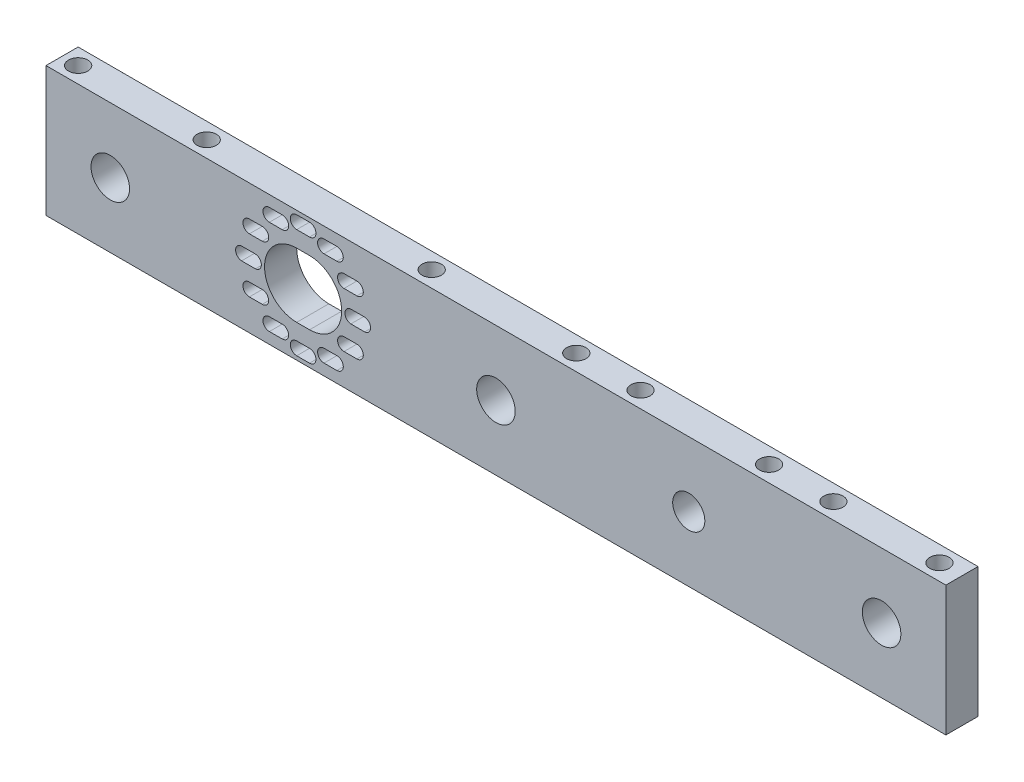
from build123d import *

# Parameters (mm, degrees)
SKETCH_1_W          = 140
SKETCH_1_H          = 20.2
SKETCH_1_R          = 3
SKETCH_1_R_2        = 2.5
EXTRUDE_1_DEPTH     = 5
CUT_EXTRUDE_1_DEPTH = 41


with BuildPart() as part:
    # 스케치1 → 돌출1 (new body)
    with BuildSketch(Plane.XY):
        with Locations((12.953994506, 0)):
            Rectangle(SKETCH_1_W, SKETCH_1_H)
        with Locations((-47.044353904, 0)):
            Circle(SKETCH_1_R, mode=Mode.SUBTRACT)
        with Locations((12.955646096, 0)):
            Circle(SKETCH_1_R, mode=Mode.SUBTRACT)
        with Locations((42.953994506, 0)):
            Circle(SKETCH_1_R_2, mode=Mode.SUBTRACT)
        with Locations((72.953994506, 0)):
            Circle(SKETCH_1_R, mode=Mode.SUBTRACT)
        with BuildLine():
            Line((-16.044353904, 5), (-18.044353904, 5))
            ThreePointArc((-18.044353904, 5), (-23.044353904, 0), (-18.044353904, -5))
            Line((-18.044353904, -5), (-16.044353904, -5))
            ThreePointArc((-16.044353904, -5), (-11.044353904, 0), (-16.044353904, 5))
        make_face(mode=Mode.SUBTRACT)
        with BuildLine():
            Line((-16.044353904, 7.5), (-18.044353904, 7.5))
            ThreePointArc((-18.044353904, 7.5), (-19.044353904, 8.5), (-18.044353904, 9.5))
            Line((-18.044353904, 9.5), (-16.044353904, 9.5))
            ThreePointArc((-16.044353904, 9.5), (-15.044353904, 8.5), (-16.044353904, 7.5))
        make_face(mode=Mode.SUBTRACT)
        with BuildLine():
            Line((-10.683137972, -5.25), (-8.683137972, -5.25))
            ThreePointArc((-8.683137972, -5.25), (-7.683137972, -4.25), (-8.683137972, -3.25))
            Line((-8.683137972, -3.25), (-10.683137972, -3.25))
            ThreePointArc((-10.683137972, -3.25), (-11.683137972, -4.25), (-10.683137972, -5.25))
        make_face(mode=Mode.SUBTRACT)
        with BuildLine():
            Line((-9.620718033, -1), (-7.467989775, -1))
            ThreePointArc((-7.467989775, -1), (-6.543625234, 0.036752017), (-7.544353904, 1))
            Line((-7.544353904, 1), (-9.544353904, 1))
            ThreePointArc((-9.544353904, 1), (-10.545082573, 0.036752017), (-9.620718033, -1))
        make_face(mode=Mode.SUBTRACT)
        with BuildLine():
            Line((-20.294353904, 8.361215932), (-22.294353904, 8.361215932))
            ThreePointArc((-22.294353904, 8.361215932), (-23.294353904, 7.361215932), (-22.294353904, 6.361215932))
            Line((-22.294353904, 6.361215932), (-20.294353904, 6.361215932))
            ThreePointArc((-20.294353904, 6.361215932), (-19.294353904, 7.361215932), (-20.294353904, 8.361215932))
        make_face(mode=Mode.SUBTRACT)
        with BuildLine():
            Line((-23.405569836, 5.25), (-25.405569836, 5.25))
            ThreePointArc((-25.405569836, 5.25), (-26.405569836, 4.25), (-25.405569836, 3.25))
            Line((-25.405569836, 3.25), (-23.405569836, 3.25))
            ThreePointArc((-23.405569836, 3.25), (-22.405569836, 4.25), (-23.405569836, 5.25))
        make_face(mode=Mode.SUBTRACT)
        with BuildLine():
            Line((-24.544353904, 1), (-26.544353904, 1))
            ThreePointArc((-26.544353904, 1), (-27.545082573, 0.036752017), (-26.620718033, -1))
            Line((-26.620718033, -1), (-24.467989775, -1))
            ThreePointArc((-24.467989775, -1), (-23.543625234, 0.036752017), (-24.544353904, 1))
        make_face(mode=Mode.SUBTRACT)
        with BuildLine():
            Line((-10.683137972, 3.25), (-8.683137972, 3.25))
            ThreePointArc((-8.683137972, 3.25), (-7.683137972, 4.25), (-8.683137972, 5.25))
            Line((-8.683137972, 5.25), (-10.683137972, 5.25))
            ThreePointArc((-10.683137972, 5.25), (-11.683137972, 4.25), (-10.683137972, 3.25))
        make_face(mode=Mode.SUBTRACT)
        with BuildLine():
            Line((-13.794353904, 6.361215932), (-11.794353904, 6.361215932))
            ThreePointArc((-11.794353904, 6.361215932), (-10.794353904, 7.361215932), (-11.794353904, 8.361215932))
            Line((-11.794353904, 8.361215932), (-13.794353904, 8.361215932))
            ThreePointArc((-13.794353904, 8.361215932), (-14.794353904, 7.361215932), (-13.794353904, 6.361215932))
        make_face(mode=Mode.SUBTRACT)
        with BuildLine():
            Line((-23.405569836, -3.25), (-25.405569836, -3.25))
            ThreePointArc((-25.405569836, -3.25), (-26.405569836, -4.25), (-25.405569836, -5.25))
            Line((-25.405569836, -5.25), (-23.405569836, -5.25))
            ThreePointArc((-23.405569836, -5.25), (-22.405569836, -4.25), (-23.405569836, -3.25))
        make_face(mode=Mode.SUBTRACT)
        with BuildLine():
            Line((-13.794353904, -8.361215932), (-11.794353904, -8.361215932))
            ThreePointArc((-11.794353904, -8.361215932), (-10.794353904, -7.361215932), (-11.794353904, -6.361215932))
            Line((-11.794353904, -6.361215932), (-13.794353904, -6.361215932))
            ThreePointArc((-13.794353904, -6.361215932), (-14.794353904, -7.361215932), (-13.794353904, -8.361215932))
        make_face(mode=Mode.SUBTRACT)
        with BuildLine():
            Line((-20.294353904, -6.361215932), (-22.294353904, -6.361215932))
            ThreePointArc((-22.294353904, -6.361215932), (-23.294353904, -7.361215932), (-22.294353904, -8.361215932))
            Line((-22.294353904, -8.361215932), (-20.294353904, -8.361215932))
            ThreePointArc((-20.294353904, -8.361215932), (-19.294353904, -7.361215932), (-20.294353904, -6.361215932))
        make_face(mode=Mode.SUBTRACT)
        with BuildLine():
            Line((-16.044353904, -9.5), (-18.044353904, -9.5))
            ThreePointArc((-18.044353904, -9.5), (-19.044353904, -8.5), (-18.044353904, -7.5))
            Line((-18.044353904, -7.5), (-16.044353904, -7.5))
            ThreePointArc((-16.044353904, -7.5), (-15.044353904, -8.5), (-16.044353904, -9.5))
        make_face(mode=Mode.SUBTRACT)
    extrude(amount=EXTRUDE_1_DEPTH)

    # 스케치8 → 컷-돌출1 (cut)
    with BuildSketch(Plane.XZ.offset(10.1)):
        with BuildLine():
            ThreePointArc((77.953994506, 2.5), (79.453994506, 1), (80.953994506, 2.5))
            Line((80.953994506, 2.5), (77.953994506, 2.5))
        make_face()
        with BuildLine():
            Line((77.953994506, 2.5), (80.953994506, 2.5))
            ThreePointArc((80.953994506, 2.5), (79.453994506, 4), (77.953994506, 2.5))
        make_face()
        with BuildLine():
            ThreePointArc((61.453994506, 2.5), (62.953994506, 1), (64.453994506, 2.5))
            Line((64.453994506, 2.5), (61.453994506, 2.5))
        make_face()
        with BuildLine():
            Line((61.453994506, 2.5), (64.453994506, 2.5))
            ThreePointArc((64.453994506, 2.5), (62.953994506, 4), (61.453994506, 2.5))
        make_face()
        with BuildLine():
            ThreePointArc((51.453994506, 2.5), (52.953994506, 1), (54.453994506, 2.5))
            Line((54.453994506, 2.5), (51.453994506, 2.5))
        make_face()
        with BuildLine():
            Line((51.453994506, 2.5), (54.453994506, 2.5))
            ThreePointArc((54.453994506, 2.5), (52.953994506, 4), (51.453994506, 2.5))
        make_face()
        with BuildLine():
            ThreePointArc((31.453994506, 2.5), (32.953994506, 1), (34.453994506, 2.5))
            Line((34.453994506, 2.5), (31.453994506, 2.5))
        make_face()
        with BuildLine():
            Line((31.453994506, 2.5), (34.453994506, 2.5))
            ThreePointArc((34.453994506, 2.5), (32.953994506, 4), (31.453994506, 2.5))
        make_face()
        with BuildLine():
            ThreePointArc((21.453994506, 2.5), (22.953994506, 1), (24.453994506, 2.5))
            Line((24.453994506, 2.5), (21.453994506, 2.5))
        make_face()
        with BuildLine():
            Line((21.453994506, 2.5), (24.453994506, 2.5))
            ThreePointArc((24.453994506, 2.5), (22.953994506, 4), (21.453994506, 2.5))
        make_face()
        with BuildLine():
            ThreePointArc((-1.044353904, 2.5), (0.455646096, 1), (1.955646096, 2.5))
            Line((1.955646096, 2.5), (-1.044353904, 2.5))
        make_face()
        with BuildLine():
            Line((-1.044353904, 2.5), (1.955646096, 2.5))
            ThreePointArc((1.955646096, 2.5), (0.455646096, 4), (-1.044353904, 2.5))
        make_face()
        with BuildLine():
            ThreePointArc((-36.044353904, 2.5), (-34.544353904, 1), (-33.044353904, 2.5))
            Line((-33.044353904, 2.5), (-36.044353904, 2.5))
        make_face()
        with BuildLine():
            Line((-36.044353904, 2.5), (-33.044353904, 2.5))
            ThreePointArc((-33.044353904, 2.5), (-34.544353904, 4), (-36.044353904, 2.5))
        make_face()
        with BuildLine():
            ThreePointArc((-56.044353904, 2.5), (-54.544353904, 1), (-53.044353904, 2.5))
            Line((-53.044353904, 2.5), (-56.044353904, 2.5))
        make_face()
        with BuildLine():
            Line((-56.044353904, 2.5), (-53.044353904, 2.5))
            ThreePointArc((-53.044353904, 2.5), (-54.544353904, 4), (-56.044353904, 2.5))
        make_face()
    extrude(amount=-CUT_EXTRUDE_1_DEPTH, mode=Mode.SUBTRACT)


solid = part.part
